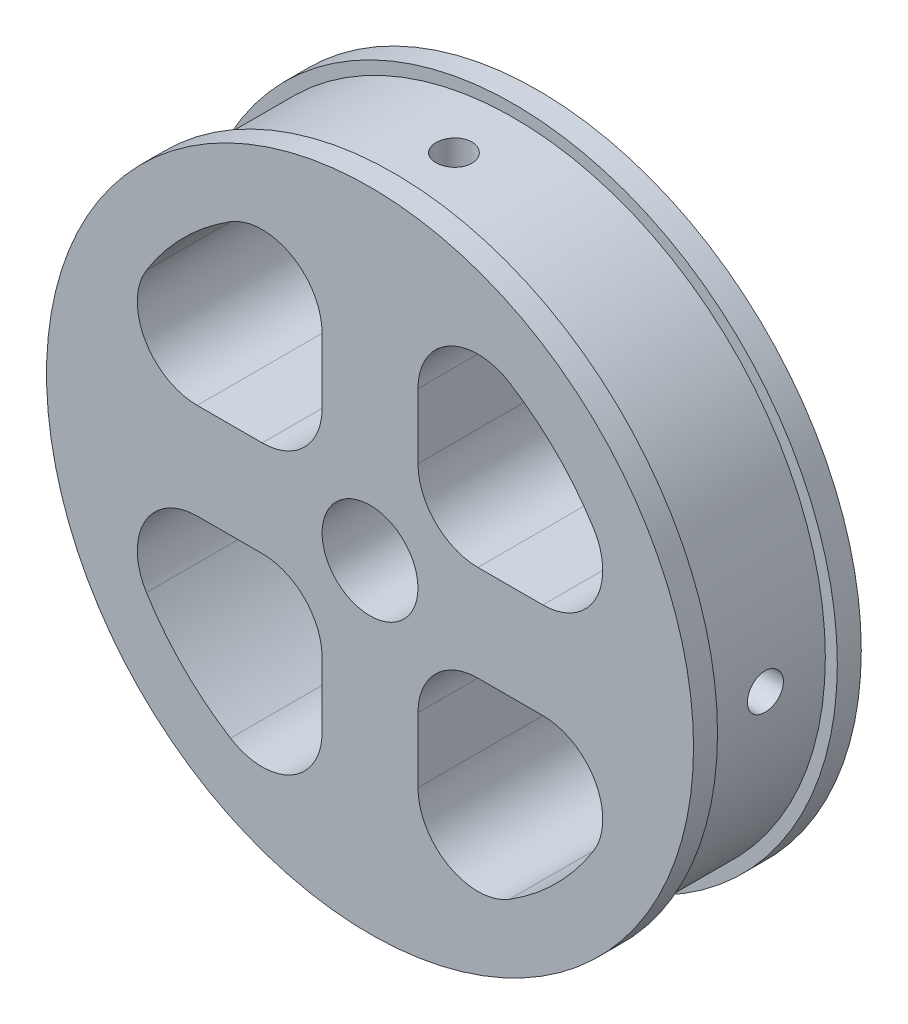
from build123d import *

# Parameters (mm, degrees)
ESQUISSE1_R             = 27
BOSS_EXTRU_1_DEPTH      = 2
ESQUISSE2_R             = 26
BOSS_EXTRU_2_DEPTH      = 10
ESQUISSE3_R             = 27
BOSS_EXTRU_3_DEPTH      = 2
ESQUISSE4_R             = 4
ENL_V_MAT_EXTRU_1_DEPTH = 41.669398815
ENL_V_MAT_EXTRU_2_DEPTH = 41.669398815
ESQUISSE6_R             = 1.5
ENL_V_MAT_EXTRU_3_DEPTH = 62.10646447
ESQUISSE7_R             = 1.5
ENL_V_MAT_EXTRU_4_DEPTH = 62.106464493


with BuildPart() as part:
    # Esquisse1 → Boss.-Extru.1 (new body)
    with BuildSketch(Plane.XY):
        Circle(ESQUISSE1_R)
    extrude(amount=BOSS_EXTRU_1_DEPTH)

    # Esquisse2 → Boss.-Extru.2 (add)
    with BuildSketch(Plane.XY.offset(2)):
        Circle(ESQUISSE2_R)
    extrude(amount=BOSS_EXTRU_2_DEPTH)

    # Esquisse3 → Boss.-Extru.3 (add)
    with BuildSketch(Plane.XY.offset(12)):
        Circle(ESQUISSE3_R)
    extrude(amount=BOSS_EXTRU_3_DEPTH)

    # Esquisse4 → Enlèv. mat.-Extru.1 (cut, through all)
    with BuildSketch(Plane.XY.offset(14)):
        Circle(ESQUISSE4_R)
    extrude(amount=-ENL_V_MAT_EXTRU_1_DEPTH, mode=Mode.SUBTRACT)

    # Esquisse5 → Enlèv. mat.-Extru.2 (cut, through all)
    with BuildSketch(Plane.XY.offset(14)):
        with BuildLine():
            Line((-4, 14.422205102), (-4, 9))
            ThreePointArc((-4, 9), (-5.464466094, 5.464466094), (-9, 4))
            Line((-9, 4), (-14.422205102, 4))
            ThreePointArc((-14.422205102, 4), (-18.794578263, 6.57464375), (-18.664030132, 11.647058824))
            ThreePointArc((-18.664030132, 11.647058824), (-15.556349186, 15.556349186), (-11.647058824, 18.664030132))
            ThreePointArc((-11.647058824, 18.664030132), (-6.57464375, 18.794578263), (-4, 14.422205102))
        make_face()
        with BuildLine():
            Line((4, 14.422205102), (4, 9))
            ThreePointArc((4, 9), (5.464466094, 5.464466094), (9, 4))
            Line((9, 4), (14.422205102, 4))
            ThreePointArc((14.422205102, 4), (18.794578263, 6.57464375), (18.664030132, 11.647058824))
            ThreePointArc((18.664030132, 11.647058824), (15.556349186, 15.556349186), (11.647058824, 18.664030132))
            ThreePointArc((11.647058824, 18.664030132), (6.57464375, 18.794578263), (4, 14.422205102))
        make_face()
        with BuildLine():
            Line((14.422205102, -4), (9, -4))
            ThreePointArc((9, -4), (5.464466094, -5.464466094), (4, -9))
            Line((4, -9), (4, -14.422205102))
            ThreePointArc((4, -14.422205102), (6.57464375, -18.794578263), (11.647058824, -18.664030132))
            ThreePointArc((11.647058824, -18.664030132), (15.556349186, -15.556349186), (18.664030132, -11.647058824))
            ThreePointArc((18.664030132, -11.647058824), (18.794578263, -6.57464375), (14.422205102, -4))
        make_face()
        with BuildLine():
            Line((-4, -9), (-4, -14.422205102))
            ThreePointArc((-4, -14.422205102), (-6.57464375, -18.794578263), (-11.647058824, -18.664030132))
            ThreePointArc((-11.647058824, -18.664030132), (-15.556349186, -15.556349186), (-18.664030132, -11.647058824))
            ThreePointArc((-18.664030132, -11.647058824), (-18.794578263, -6.57464375), (-14.422205102, -4))
            Line((-14.422205102, -4), (-9, -4))
            ThreePointArc((-9, -4), (-5.464466094, -5.464466094), (-4, -9))
        make_face()
    extrude(amount=-ENL_V_MAT_EXTRU_2_DEPTH, mode=Mode.SUBTRACT)

    # Esquisse6 → Enlèv. mat.-Extru.3 (cut, through all)
    with BuildSketch(Plane(origin=(0, 26, 0), x_dir=(-1, 0, 0), z_dir=(0, 1, 0))):
        with Locations((0, 7)):
            Circle(ESQUISSE6_R)
    extrude(amount=-ENL_V_MAT_EXTRU_3_DEPTH, mode=Mode.SUBTRACT)

    # Esquisse7 → Enlèv. mat.-Extru.4 (cut, through all)
    with BuildSketch(Plane.ZY.offset(26)):
        with Locations(Location((7, 0, 0), (0, 0, 270))):
            Circle(ESQUISSE7_R)
    extrude(amount=-ENL_V_MAT_EXTRU_4_DEPTH, mode=Mode.SUBTRACT)


solid = part.part
